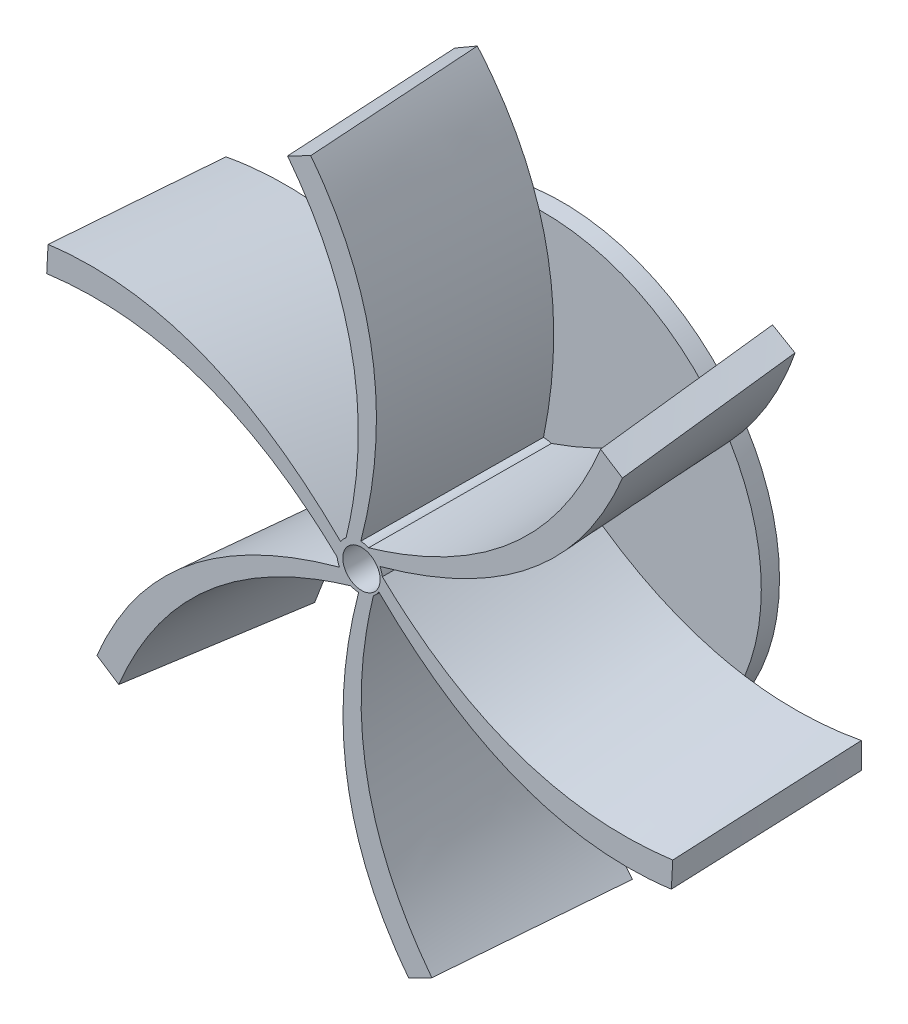
from build123d import *

# Parameters (mm, degrees)
SKETCH1_R           = 11.95
SKETCH1_R_2         = 1.25
BOSS_EXTRUDE5_DEPTH = 1
SKETCH1_9_R         = 1.25
BOSS_EXTRUDE9_DEPTH = 1
SKETCH1_12_R        = 1.025
CUT_EXTRUDE6_DEPTH  = 28.53713591


with BuildPart() as part:
    # Sketch1 → Boss-Extrude5 (new body)
    with BuildSketch(Plane.XY):
        Circle(SKETCH1_R)
        Circle(SKETCH1_R_2, mode=Mode.SUBTRACT)
    extrude(amount=BOSS_EXTRUDE5_DEPTH)

    # Sketch1<9> → Boss-Extrude9 (add)
    with BuildSketch(Plane.XY):
        Circle(SKETCH1_9_R)
    extrude(amount=BOSS_EXTRUDE9_DEPTH)

    # Sketch16 for Loft3 → Loft3 section 0
    with BuildSketch(Plane.XY.offset(1)):
        with BuildLine():
            Line((12.566853953, 12.883098649), (13.802379149, 12.169767844))
            add(Edge.make_bspline(
                [(1.079738119, 0.629813936), (10.901614273, 3.888080069), (13.802379149, 12.169767844)],
                knots=[0, 0, 0, 1, 1, 1], degree=2))
            # circular arc as an exact rational Bezier (weights 1, cos(half-angle), 1)
            Bezier((1.079738119, 0.629813936), (1.192655997, 0.436230196), (1.231288084, 0.215475415), weights=[1, 0.984305335, 1])
            add(Edge.make_bspline(
                [(1.231288084, 0.215475415), (8.568925474, -6.096520826), (17.440517686, -4.441665445)],
                knots=[0, 0, 0, 1, 1, 1], degree=2))
            Line((17.440517686, -4.441665445), (17.440517686, -5.868327054))
            add(Edge.make_bspline(
                [(1.085303928, -0.620173673), (8.817983248, -7.497034868), (17.440517686, -5.868327054)],
                knots=[0, 0, 0, 1, 1, 1], degree=2))
            Bezier((1.085303928, -0.620173673), (0.97411443, -0.814755294), (0.802251225, -0.958589053), weights=[1, 0.984305335, 1])
            add(Edge.make_bspline(
                [(0.802251225, -0.958589053), (-0.995279173, -10.469167557), (4.873663733, -17.324764093)],
                knots=[0, 0, 0, 1, 1, 1], degree=2))
            Line((4.873663733, -17.324764093), (3.638138537, -18.038094898))
            add(Edge.make_bspline(
                [(0.005565808, -1.249987609), (-2.083631025, -11.385114937), (3.638138537, -18.038094898)],
                knots=[0, 0, 0, 1, 1, 1], degree=2))
            Bezier((0.005565808, -1.249987609), (-0.218541567, -1.250985489), (-0.429036859, -1.174064467), weights=[1, 0.984305335, 1])
            add(Edge.make_bspline(
                [(-0.429036859, -1.174064467), (-9.564204647, -4.37264673), (-12.566853953, -12.883098649)],
                knots=[0, 0, 0, 1, 1, 1], degree=2))
            Line((-12.566853953, -12.883098649), (-13.802379149, -12.169767844))
            add(Edge.make_bspline(
                [(-1.079738119, -0.629813936), (-10.901614273, -3.888080069), (-13.802379149, -12.169767844)],
                knots=[0, 0, 0, 1, 1, 1], degree=2))
            Bezier((-1.079738119, -0.629813936), (-1.192655997, -0.436230196), (-1.231288084, -0.215475415), weights=[1, 0.984305335, 1])
            add(Edge.make_bspline(
                [(-1.231288084, -0.215475415), (-8.568925474, 6.096520826), (-17.440517686, 4.441665445)],
                knots=[0, 0, 0, 1, 1, 1], degree=2))
            Line((-17.440517686, 4.441665445), (-17.440517686, 5.868327054))
            add(Edge.make_bspline(
                [(-1.085303928, 0.620173673), (-8.817983248, 7.497034868), (-17.440517686, 5.868327054)],
                knots=[0, 0, 0, 1, 1, 1], degree=2))
            Bezier((-1.085303928, 0.620173673), (-0.97411443, 0.814755294), (-0.802251225, 0.958589053), weights=[1, 0.984305335, 1])
            add(Edge.make_bspline(
                [(-0.802251225, 0.958589053), (0.995279173, 10.469167557), (-4.873663733, 17.324764093)],
                knots=[0, 0, 0, 1, 1, 1], degree=2))
            Line((-4.873663733, 17.324764093), (-3.638138537, 18.038094898))
            add(Edge.make_bspline(
                [(-0.005565808, 1.249987609), (2.083631025, 11.385114937), (-3.638138537, 18.038094898)],
                knots=[0, 0, 0, 1, 1, 1], degree=2))
            Bezier((-0.005565808, 1.249987609), (0.218541567, 1.250985489), (0.429036859, 1.174064467), weights=[1, 0.984305335, 1])
            add(Edge.make_bspline(
                [(0.429036859, 1.174064467), (9.564204647, 4.37264673), (12.566853953, 12.883098649)],
                knots=[0, 0, 0, 1, 1, 1], degree=2))
        make_face()
    # Sketch22 for Loft3 → Loft3 section 1
    with BuildSketch(Plane.XY.offset(11)):
        with BuildLine():
            Line((13.128169943, 12.255599921), (14.324669046, 11.478584319))
            add(Edge.make_bspline(
                [(1.01550943, 0.620297101), (10.994449518, 3.360060613), (14.324669046, 11.478584319)],
                knots=[0, 0, 0, 1, 1, 1], degree=2))
            Bezier((1.01550943, 0.620297101), (1.118141168, 0.421068995), (1.145166898, 0.198594904), weights=[1, 0.984305335, 1])
            add(Edge.make_bspline(
                [(1.145166898, 0.198594904), (8.142403952, -6.488773235), (17.088446394, -5.300489037)],
                knots=[0, 0, 0, 1, 1, 1], degree=2))
            Line((17.088446394, -5.300489037), (17.013780694, -6.725195456))
            add(Edge.make_bspline(
                [(0.955648314, -0.628268735), (8.31782316, -7.900402598), (17.013780694, -6.725195456)],
                knots=[0, 0, 0, 1, 1, 1], degree=2))
            Bezier((0.955648314, -0.628268735), (0.834427583, -0.81676448), (0.655272233, -0.951406495), weights=[1, 0.984305335, 1])
            add(Edge.make_bspline(
                [(0.655272233, -0.951406495), (-1.637539933, -10.354875609), (3.86456559, -17.508233528)],
                knots=[0, 0, 0, 1, 1, 1], degree=2))
            Line((3.86456559, -17.508233528), (2.593400789, -18.155924345))
            add(Edge.make_bspline(
                [(-0.155571976, -1.200710406), (-2.772337218, -11.21260778), (2.593400789, -18.155924345)],
                knots=[0, 0, 0, 1, 1, 1], degree=2))
            Bezier((-0.155571976, -1.200710406), (-0.379424445, -1.189978045), (-0.585605526, -1.102145969), weights=[1, 0.984305335, 1])
            add(Edge.make_bspline(
                [(-0.585605526, -1.102145969), (-9.875654745, -3.818246944), (-13.319591664, -12.159889061)],
                knots=[0, 0, 0, 1, 1, 1], degree=2))
            Line((-13.319591664, -12.159889061), (-14.516090766, -11.382873459))
            add(Edge.make_bspline(
                [(-1.20693115, -0.524586241), (-11.185871238, -3.264349753), (-14.516090766, -11.382873459)],
                knots=[0, 0, 0, 1, 1, 1], degree=2))
            Bezier((-1.20693115, -0.524586241), (-1.309562888, -0.325358135), (-1.336588618, -0.102884044), weights=[1, 0.984305335, 1])
            add(Edge.make_bspline(
                [(-1.336588618, -0.102884044), (-8.333825672, 6.584484095), (-17.279868114, 5.396199897)],
                knots=[0, 0, 0, 1, 1, 1], degree=2))
            Line((-17.279868114, 5.396199897), (-17.205202415, 6.820906316))
            add(Edge.make_bspline(
                [(-1.147070034, 0.723979595), (-8.50924488, 7.996113458), (-17.205202415, 6.820906316)],
                knots=[0, 0, 0, 1, 1, 1], degree=2))
            Bezier((-1.147070034, 0.723979595), (-1.025849303, 0.91247534), (-0.846693953, 1.047117355), weights=[1, 0.984305335, 1])
            add(Edge.make_bspline(
                [(-0.846693953, 1.047117355), (1.446118213, 10.450586469), (-4.055987311, 17.603944388)],
                knots=[0, 0, 0, 1, 1, 1], degree=2))
            Line((-4.055987311, 17.603944388), (-2.784822509, 18.251635205))
            add(Edge.make_bspline(
                [(-0.035849744, 1.296421266), (2.580915498, 11.30831864), (-2.784822509, 18.251635205)],
                knots=[0, 0, 0, 1, 1, 1], degree=2))
            Bezier((-0.035849744, 1.296421266), (0.188002725, 1.285688905), (0.394183805, 1.197856829), weights=[1, 0.984305335, 1])
            add(Edge.make_bspline(
                [(0.394183805, 1.197856829), (9.684233025, 3.913957804), (13.128169943, 12.255599921)],
                knots=[0, 0, 0, 1, 1, 1], degree=2))
        make_face()
    loft()

    # Sketch1<12> → Cut-Extrude6 (cut, through all)
    with BuildSketch(Plane.XY):
        Circle(SKETCH1_12_R)
    extrude(amount=CUT_EXTRUDE6_DEPTH, mode=Mode.SUBTRACT)


solid = part.part
